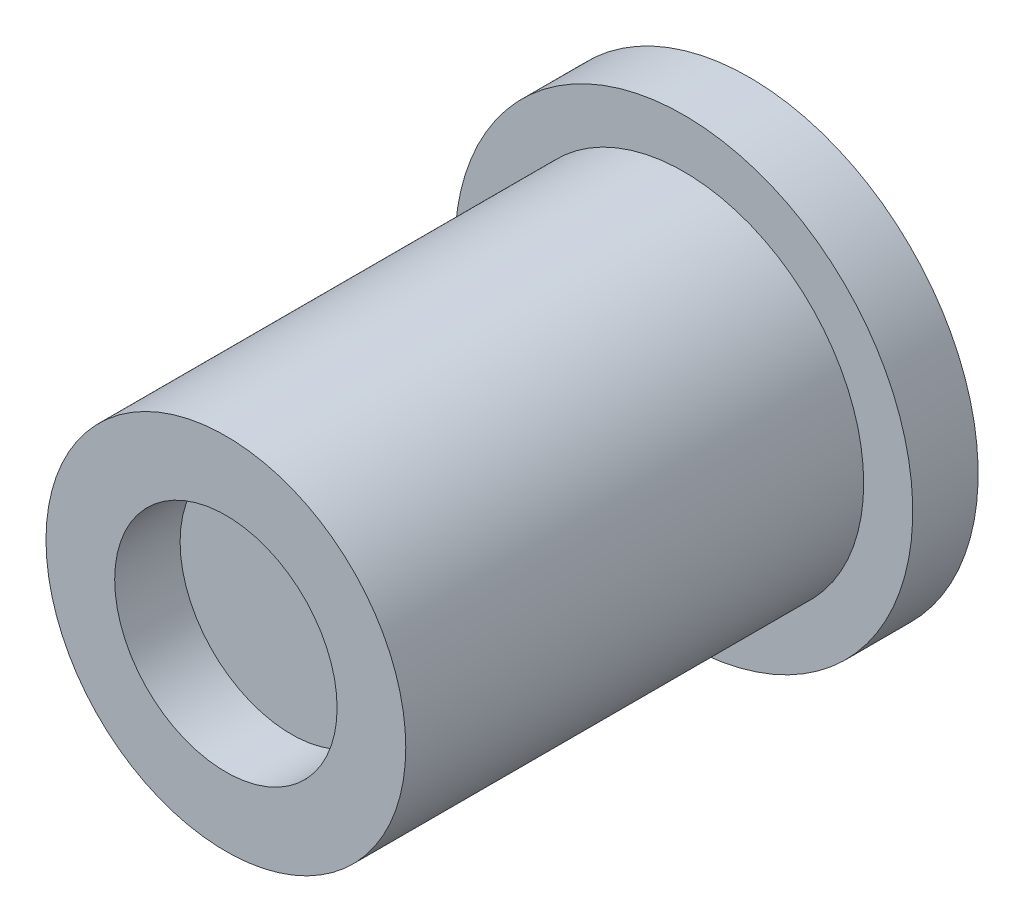
from build123d import *

# Parameters (mm, degrees)
SKETCH1_R      = 5.5
SKETCH1_R_2    = 3.4
EXTRUDE1_DEPTH = 2
EXTRUDE2_START = 12
SKETCH2_R      = 5.5
EXTRUDE2_DEPTH = 12
SKETCH3_R      = 7
EXTRUDE3_DEPTH = 2


with BuildPart() as part:
    # Sketch1 → Extrude1 (new body)
    with BuildSketch(Plane.XY):
        Circle(SKETCH1_R)
        Circle(SKETCH1_R_2, mode=Mode.SUBTRACT)
    extrude(amount=EXTRUDE1_DEPTH)

    # Sketch2 → Extrude2 (add)
    with BuildSketch(Plane(origin=(0, 0, 0), x_dir=(-1, 0, 0), z_dir=(0, 0, -1)).offset(EXTRUDE2_START)):
        Circle(SKETCH2_R)
    extrude(amount=-EXTRUDE2_DEPTH)

    # Sketch3 → Extrude3 (add)
    with BuildSketch(Plane(origin=(0, 0, -12), x_dir=(-1, 0, 0), z_dir=(0, 0, -1))):
        Circle(SKETCH3_R)
    extrude(amount=EXTRUDE3_DEPTH)


solid = part.part
